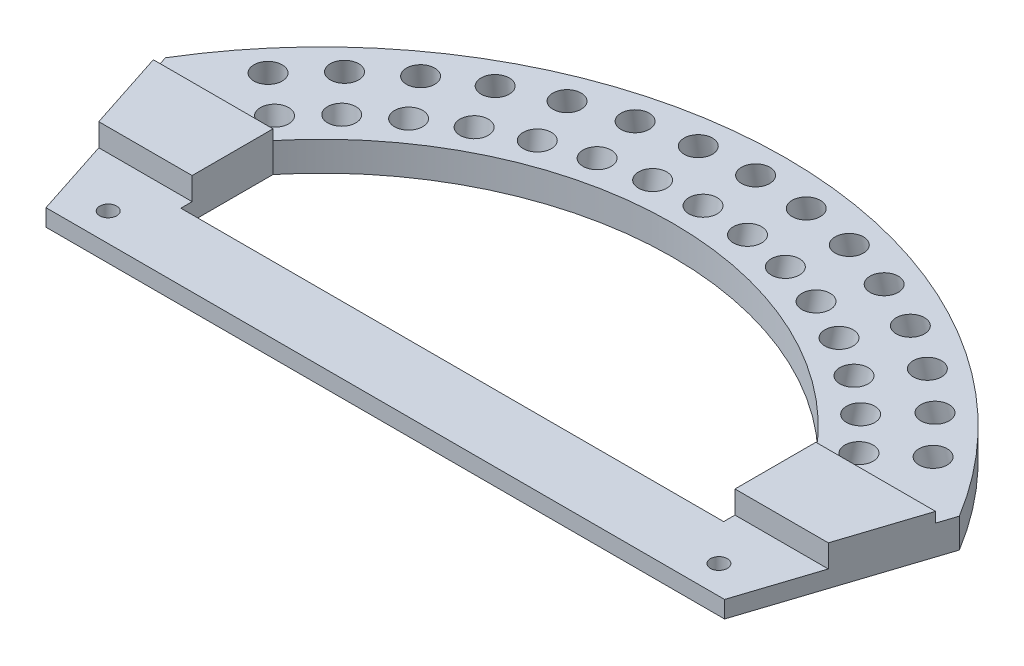
from build123d import *

# Parameters (mm, degrees)
SKETCH1_R           = 1.5
BOSS_EXTRUDE1_DEPTH = 3
BOSS_EXTRUDE2_DEPTH = 2.2
BOSS_EXTRUDE3_DEPTH = 4
SKETCH4_R           = 2.5
CUT_EXTRUDE2_DEPTH  = 15.2
CUT_EXTRUDE3_DEPTH  = 13.5
CIRPATTERN1_COUNT   = 8
CIRPATTERN1_ANGLE   = 50
CIRPATTERN2_COUNT   = 8
CIRPATTERN2_ANGLE   = 50
CIRPATTERN3_COUNT   = 8
CIRPATTERN3_ANGLE   = 50
CIRPATTERN4_COUNT   = 8
CIRPATTERN4_ANGLE   = 50


with BuildPart() as part:
    # Sketch1 → Boss-Extrude1 (new body)
    with BuildSketch(Plane(origin=(0, 0, 0), x_dir=(1, 0, 0), z_dir=(0, 1, 0))):
        with BuildLine():
            Line((-60, 11.27), (60, 11.27))
            Line((60, 11.27), (70.199717931, 42.593662822))
            ThreePointArc((70.199717931, 42.593662822), (0, 82.111025509), (-70.199717931, 42.593662822))
            Line((-70.199717931, 42.593662822), (-60, 11.27))
        make_face()
        with Locations(Location((-54, 16.27, 0), (0, 0, 270))):
            Circle(SKETCH1_R, mode=Mode.SUBTRACT)
        with Locations(Location((54, 16.27, 0), (0, 0, 270))):
            Circle(SKETCH1_R, mode=Mode.SUBTRACT)
        with BuildLine():
            Line((48, 23.11), (-48, 23.11))
            Line((-48, 23.11), (-48, 39.418009714))
            ThreePointArc((-48, 39.418009714), (0, 62.111025509), (48, 39.418009714))
            Line((48, 39.418009714), (48, 23.11))
        make_face(mode=Mode.SUBTRACT)
    extrude(amount=BOSS_EXTRUDE1_DEPTH)

    # Sketch2 → Boss-Extrude2 (add)
    with BuildSketch(Plane(origin=(0, 3, 0), x_dir=(1, 0, 0), z_dir=(0, 1, 0))):
        with BuildLine():
            Line((-69.165650934, 39.418009714), (-48, 39.418009714))
            ThreePointArc((-48, 39.418009714), (0, 62.111025509), (48, 39.418009714))
            Line((48, 39.418009714), (69.165650934, 39.418009714))
            Line((69.165650934, 39.418009714), (70.199717931, 42.593662822))
            ThreePointArc((70.199717931, 42.593662822), (0, 82.111025509), (-70.199717931, 42.593662822))
            Line((-70.199717931, 42.593662822), (-69.165650934, 39.418009714))
        make_face()
    extrude(amount=BOSS_EXTRUDE2_DEPTH)

    # Sketch3 → Boss-Extrude3 (add)
    with BuildSketch(Plane(origin=(0, 3, 0), x_dir=(1, 0, 0), z_dir=(0, 1, 0))):
        Polygon((-48, 25.11), (-48, 39.418009714), (-69.165650934, 39.418009714), (-64.506628007, 25.11), align=None)
        Polygon((48, 39.418009714), (48, 25.11), (64.506628007, 25.11), (69.165650934, 39.418009714), align=None)
    extrude(amount=BOSS_EXTRUDE3_DEPTH)

    # Sketch4 → Cut-Extrude2 (cut, along a direction that is not the sketch's normal)
    with BuildSketch(Plane.XZ.offset(-5.2)):
        with Locations((0, -67.461025509)):
            Circle(SKETCH4_R)
    cut_extrude2 = extrude(amount=CUT_EXTRUDE2_DEPTH, dir=(0, -0.9848077530122091, 0.17364817766692467), mode=Mode.SUBTRACT)

    # Sketch7 → Cut-Extrude3 (cut, along a direction that is not the sketch's normal)
    with BuildSketch(Plane(origin=(0, 5.2, 0), x_dir=(1, 0, 0), z_dir=(0, 1, 0))):
        with BuildLine():
            ThreePointArc((0, 79.261025509), (-2.5, 76.761025509), (0, 74.261025509))
            Line((0, 74.261025509), (0, 79.261025509))
        make_face()
        with BuildLine():
            Line((0, 79.261025509), (0, 74.261025509))
            ThreePointArc((0, 74.261025509), (1.767766953, 74.993258556), (2.5, 76.761025509))
            ThreePointArc((2.5, 76.761025509), (1.767766953, 78.528792462), (0, 79.261025509))
        make_face()
    cut_extrude3 = extrude(amount=-CUT_EXTRUDE3_DEPTH, dir=(0, 0.9848077530122096, 0.1736481776669219), mode=Mode.SUBTRACT)

    # CirPattern1: Cut-Extrude2 ×8 about axis
    cirpattern1_axis = Axis((0, 0, 0), (0, -1, 0))
    for i in range(1, CIRPATTERN1_COUNT):
        add(cut_extrude2.rotate(cirpattern1_axis, i * CIRPATTERN1_ANGLE / (CIRPATTERN1_COUNT - 1)), mode=Mode.SUBTRACT)

    # CirPattern2: Cut-Extrude2 ×8 about axis
    cirpattern2_axis = Axis((0, 0, 0), (0, 1, 0))
    for i in range(1, CIRPATTERN2_COUNT):
        add(cut_extrude2.rotate(cirpattern2_axis, i * CIRPATTERN2_ANGLE / (CIRPATTERN2_COUNT - 1)), mode=Mode.SUBTRACT)

    # CirPattern3: Cut-Extrude3 ×8 about axis
    cirpattern3_axis = Axis((0, 0, 0), (0, 1, 0))
    for i in range(1, CIRPATTERN3_COUNT):
        add(cut_extrude3.rotate(cirpattern3_axis, i * CIRPATTERN3_ANGLE / (CIRPATTERN3_COUNT - 1)), mode=Mode.SUBTRACT)

    # CirPattern4: Cut-Extrude3 ×8 about axis
    cirpattern4_axis = Axis((0, 0, 0), (0, -1, 0))
    for i in range(1, CIRPATTERN4_COUNT):
        add(cut_extrude3.rotate(cirpattern4_axis, i * CIRPATTERN4_ANGLE / (CIRPATTERN4_COUNT - 1)), mode=Mode.SUBTRACT)


solid = part.part
